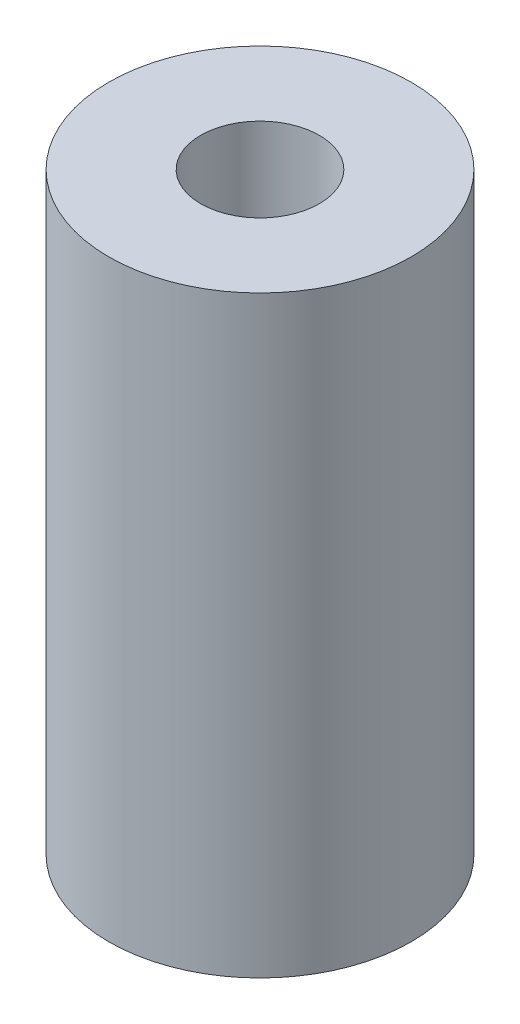
from build123d import *

# Parameters (mm, degrees)
SKETCH_1_R      = 25.5
SKETCH_1_R_2    = 10
EXTRUDE_1_DEPTH = 100


with BuildPart() as part:
    # 스케치1 → 보스-돌출1 (new body)
    with BuildSketch(Plane(origin=(0, 0, 0), x_dir=(1, 0, 0), z_dir=(0, 1, 0))):
        with Locations(Location((0, 0, 0), (0, 0, 270))):
            Circle(SKETCH_1_R)
        with Locations(Location((0, 0, 0), (0, 0, 270))):
            Circle(SKETCH_1_R_2, mode=Mode.SUBTRACT)
    extrude(amount=EXTRUDE_1_DEPTH)


solid = part.part
